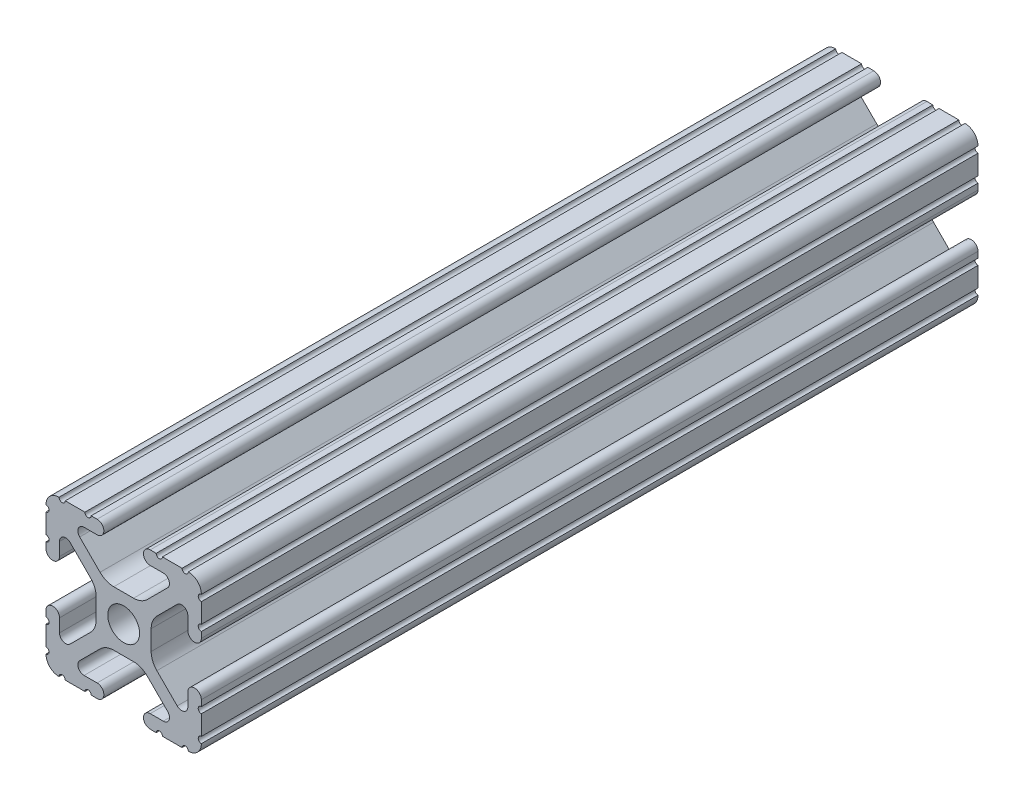
from build123d import *

# Parameters (mm, degrees)
SKETCH1_R           = 2.6035
BOSS_EXTRUDE1_DEPTH = 127


with BuildPart() as part:
    # Sketch1 → Boss-Extrude1 (new body)
    with BuildSketch(Plane(origin=(0, 0, -25.4), x_dir=(-1, 0, 0), z_dir=(0, 0, -1))):
        with BuildLine():
            Line((12.7, -9.5504), (12.7, -6.3330836))
            ThreePointArc((12.7, -6.3330836), (12.192, -5.8250836), (12.7, -5.3170836))
            Line((12.7, -5.3170836), (12.7, -4.3434))
            ThreePointArc((12.7, -4.3434), (11.5951, -3.2385), (10.4902, -4.3434))
            Line((10.4902, -4.3434), (10.4902, -6.474794456))
            ThreePointArc((10.4902, -6.474794456), (9.863006367, -7.413456061), (8.75577951, -7.193214945))
            Line((8.75577951, -7.193214945), (5.42573597, -3.863171405))
            ThreePointArc((5.42573597, -3.863171405), (4.737482484, -2.833127272), (4.4958, -1.618107374))
            Line((4.4958, -1.618107374), (4.4958, 1.618107374))
            ThreePointArc((4.4958, 1.618107374), (4.737482484, 2.833127272), (5.42573597, 3.863171405))
            Line((5.42573597, 3.863171405), (8.75577951, 7.193214945))
            ThreePointArc((8.75577951, 7.193214945), (9.863006367, 7.413456061), (10.4902, 6.474794456))
            Line((10.4902, 6.474794456), (10.4902, 4.343399971))
            ThreePointArc((10.4902, 4.343399971), (11.5951, 3.238499971), (12.7, 4.343399971))
            Line((12.7, 4.343399971), (12.7, 5.3170836))
            ThreePointArc((12.7, 5.3170836), (12.192, 5.8250836), (12.7, 6.3330836))
            Line((12.7, 6.3330836), (12.7, 9.5504))
            ThreePointArc((12.7, 9.5504), (12.192000006, 10.058323491), (12.699846982, 10.566399977))
            ThreePointArc((12.699846982, 10.566399977), (12.082522516, 12.082522516), (10.566399977, 12.699846982))
            ThreePointArc((10.566399977, 12.699846982), (10.058323491, 12.192000006), (9.5504, 12.7))
            Line((9.5504, 12.7), (6.3330836, 12.7))
            ThreePointArc((6.3330836, 12.7), (5.8250836, 12.192), (5.3170836, 12.7))
            Line((5.3170836, 12.7), (4.3434, 12.7))
            ThreePointArc((4.3434, 12.7), (3.2385, 11.5951), (4.3434, 10.4902))
            Line((4.3434, 10.4902), (6.474794456, 10.4902))
            ThreePointArc((6.474794456, 10.4902), (7.413456061, 9.863006367), (7.193214945, 8.75577951))
            Line((7.193214945, 8.75577951), (3.863171405, 5.42573597))
            ThreePointArc((3.863171405, 5.42573597), (2.833127272, 4.737482484), (1.618107374, 4.4958))
            Line((1.618107374, 4.4958), (-1.618107374, 4.4958))
            ThreePointArc((-1.618107374, 4.4958), (-2.833127272, 4.737482484), (-3.863171405, 5.42573597))
            Line((-3.863171405, 5.42573597), (-7.193214945, 8.75577951))
            ThreePointArc((-7.193214945, 8.75577951), (-7.413456061, 9.863006367), (-6.474794456, 10.4902))
            Line((-6.474794456, 10.4902), (-4.343399971, 10.4902))
            ThreePointArc((-4.343399971, 10.4902), (-3.238499971, 11.5951), (-4.343399971, 12.7))
            Line((-4.343399971, 12.7), (-5.3170836, 12.7))
            ThreePointArc((-5.3170836, 12.7), (-5.8250836, 12.192), (-6.3330836, 12.7))
            Line((-6.3330836, 12.7), (-9.5504, 12.7))
            ThreePointArc((-9.5504, 12.7), (-10.058323491, 12.192000006), (-10.566399977, 12.699846982))
            ThreePointArc((-10.566399977, 12.699846982), (-12.082522516, 12.082522516), (-12.699846982, 10.566399977))
            ThreePointArc((-12.699846982, 10.566399977), (-12.192000006, 10.058323491), (-12.7, 9.5504))
            Line((-12.7, 9.5504), (-12.7, 6.3330836))
            ThreePointArc((-12.7, 6.3330836), (-12.192, 5.8250836), (-12.7, 5.3170836))
            Line((-12.7, 5.3170836), (-12.7, 4.3434))
            ThreePointArc((-12.7, 4.3434), (-11.5951, 3.2385), (-10.4902, 4.3434))
            Line((-10.4902, 4.3434), (-10.4902, 6.474794456))
            ThreePointArc((-10.4902, 6.474794456), (-9.863006367, 7.413456061), (-8.75577951, 7.193214945))
            Line((-8.75577951, 7.193214945), (-5.42573597, 3.863171405))
            ThreePointArc((-5.42573597, 3.863171405), (-4.737482484, 2.833127272), (-4.4958, 1.618107374))
            Line((-4.4958, 1.618107374), (-4.4958, -1.618107374))
            ThreePointArc((-4.4958, -1.618107374), (-4.737482484, -2.833127272), (-5.42573597, -3.863171405))
            Line((-5.42573597, -3.863171405), (-8.75577951, -7.193214945))
            ThreePointArc((-8.75577951, -7.193214945), (-9.863006367, -7.413456061), (-10.4902, -6.474794456))
            Line((-10.4902, -6.474794456), (-10.4902, -4.343399971))
            ThreePointArc((-10.4902, -4.343399971), (-11.5951, -3.238499971), (-12.7, -4.343399971))
            Line((-12.7, -4.343399971), (-12.7, -5.3170836))
            ThreePointArc((-12.7, -5.3170836), (-12.192, -5.8250836), (-12.7, -6.3330836))
            Line((-12.7, -6.3330836), (-12.7, -9.5504))
            ThreePointArc((-12.7, -9.5504), (-12.192000006, -10.058323491), (-12.699846982, -10.566399977))
            ThreePointArc((-12.699846982, -10.566399977), (-12.082522516, -12.082522516), (-10.566399977, -12.699846982))
            ThreePointArc((-10.566399977, -12.699846982), (-10.058323491, -12.192000006), (-9.5504, -12.7))
            Line((-9.5504, -12.7), (-6.3330836, -12.7))
            ThreePointArc((-6.3330836, -12.7), (-5.8250836, -12.192), (-5.3170836, -12.7))
            Line((-5.3170836, -12.7), (-4.3434, -12.7))
            ThreePointArc((-4.3434, -12.7), (-3.2385, -11.5951), (-4.3434, -10.4902))
            Line((-4.3434, -10.4902), (-6.474794456, -10.4902))
            ThreePointArc((-6.474794456, -10.4902), (-7.413456061, -9.863006367), (-7.193214945, -8.75577951))
            Line((-7.193214945, -8.75577951), (-3.863171405, -5.42573597))
            ThreePointArc((-3.863171405, -5.42573597), (-2.833127272, -4.737482484), (-1.618107374, -4.4958))
            Line((-1.618107374, -4.4958), (1.618107374, -4.4958))
            ThreePointArc((1.618107374, -4.4958), (2.833127272, -4.737482484), (3.863171405, -5.42573597))
            Line((3.863171405, -5.42573597), (7.193214945, -8.75577951))
            ThreePointArc((7.193214945, -8.75577951), (7.413456061, -9.863006367), (6.474794456, -10.4902))
            Line((6.474794456, -10.4902), (4.343399971, -10.4902))
            ThreePointArc((4.343399971, -10.4902), (3.238499971, -11.5951), (4.343399971, -12.7))
            Line((4.343399971, -12.7), (5.3170836, -12.7))
            ThreePointArc((5.3170836, -12.7), (5.8250836, -12.192), (6.3330836, -12.7))
            Line((6.3330836, -12.7), (9.5504, -12.7))
            ThreePointArc((9.5504, -12.7), (10.058323491, -12.192000006), (10.566399977, -12.699846982))
            ThreePointArc((10.566399977, -12.699846982), (12.082522516, -12.082522516), (12.699846982, -10.566399977))
            ThreePointArc((12.699846982, -10.566399977), (12.192000006, -10.058323491), (12.7, -9.5504))
        make_face()
        with Locations(Location((0, 0, 0), (0, 0, 180))):
            Circle(SKETCH1_R, mode=Mode.SUBTRACT)
    extrude(amount=-BOSS_EXTRUDE1_DEPTH)


solid = part.part
